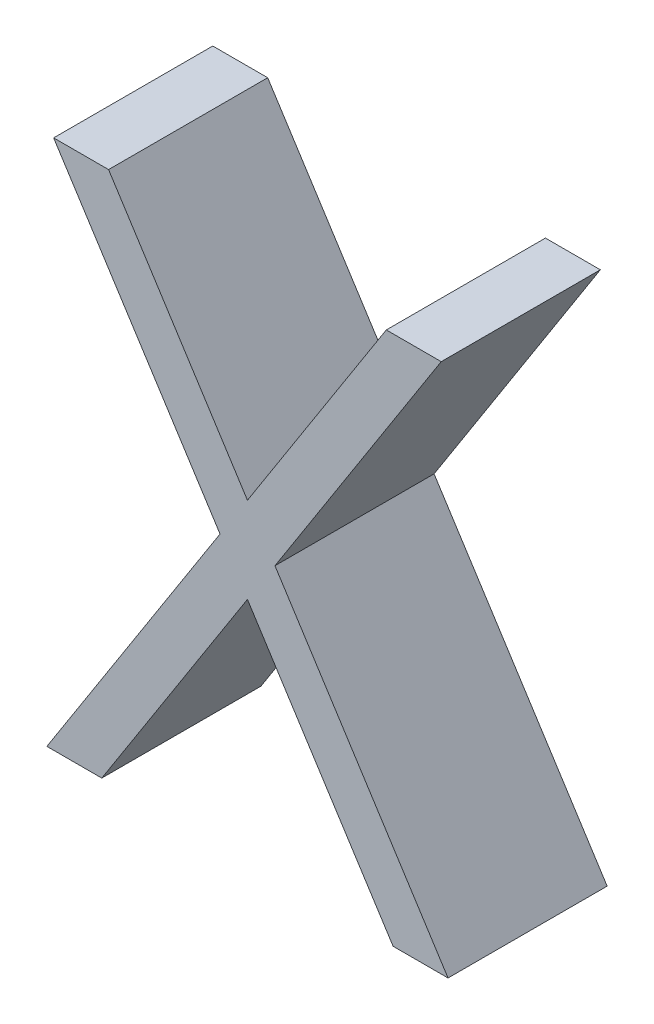
from build123d import *

# Parameters (mm, degrees)
BOSS_EXTRU_1_DEPTH = 1.5


with BuildPart() as part:
    # Esquisse1 → Boss.-Extru.1 (new body)
    with BuildSketch(Plane.XY):
        Polygon((-55.785029428, -17.870119076), (-55.267200903, -17.870119076), (-53.958106352, -19.915391512), (-52.6490118, -17.870119076), (-52.131183275, -17.870119076), (-53.698691287, -20.320038948), (-52.06708071, -22.870119076), (-52.584909236, -22.870119076), (-53.958106352, -20.724686384), (-55.331303467, -22.870119076), (-55.849131993, -22.870119076), (-54.216519813, -20.320038948), align=None)
    extrude(amount=BOSS_EXTRU_1_DEPTH)


solid = part.part
